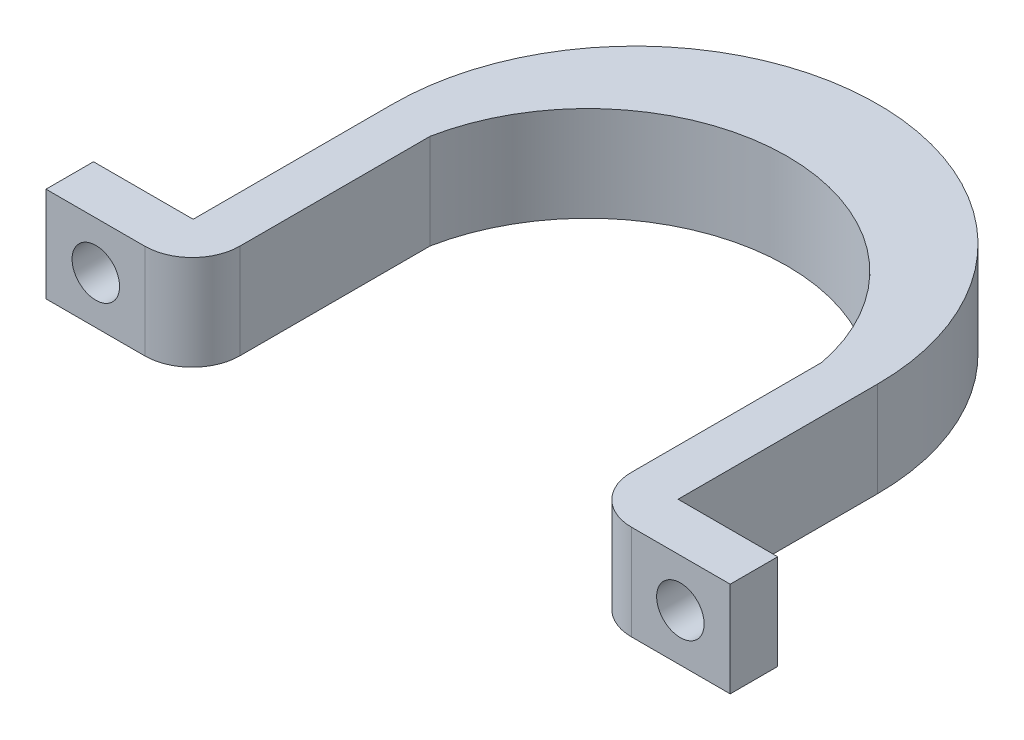
from build123d import *

# Parameters (mm, degrees)
BOSS_EXTRUDE1_DEPTH = 10
SKETCH4_R           = 2.5
CUT_EXTRUDE1_DEPTH  = 60.662529858


with BuildPart() as part:
    # Sketch1<2> → Boss-Extrude1 (new body)
    with BuildSketch(Plane(origin=(0, 0, 0), x_dir=(1, 0, 0), z_dir=(0, 1, 0))):
        with BuildLine():
            Line((-20.608028251, 4.038461538), (-20.608028251, -16))
            ThreePointArc((-20.608028251, -16), (-22.072494345, -19.535533906), (-25.608028251, -21))
            Line((-25.608028251, -21), (-36, -21))
            Line((-36, -21), (-36, -16))
            Line((-36, -16), (-25.514701644, -16))
            Line((-25.514701644, -16), (-25.514701644, 5))
            ThreePointArc((-25.514701644, 5), (0, 30.514701644), (25.514701644, 5))
            Line((25.514701644, 5), (25.514701644, -16))
            Line((25.514701644, -16), (36, -16))
            Line((36, -16), (36, -21))
            Line((36, -21), (25.608028251, -21))
            ThreePointArc((25.608028251, -21), (22.072494345, -19.535533906), (20.608028251, -16))
            Line((20.608028251, -16), (20.608028251, 4.038461538))
            ThreePointArc((20.608028251, 4.038461538), (0, 21), (-20.608028251, 4.038461538))
        make_face()
    extrude(amount=BOSS_EXTRUDE1_DEPTH)

    # Sketch4 → Cut-Extrude1 (cut, through all)
    with BuildSketch(Plane(origin=(0, 0, 16), x_dir=(-1, 0, 0), z_dir=(0, 0, -1))):
        with Locations((-30.757350822, 5)):
            Circle(SKETCH4_R)
        with Locations((30.757350822, 5)):
            Circle(SKETCH4_R)
    extrude(amount=-CUT_EXTRUDE1_DEPTH, mode=Mode.SUBTRACT)


solid = part.part
